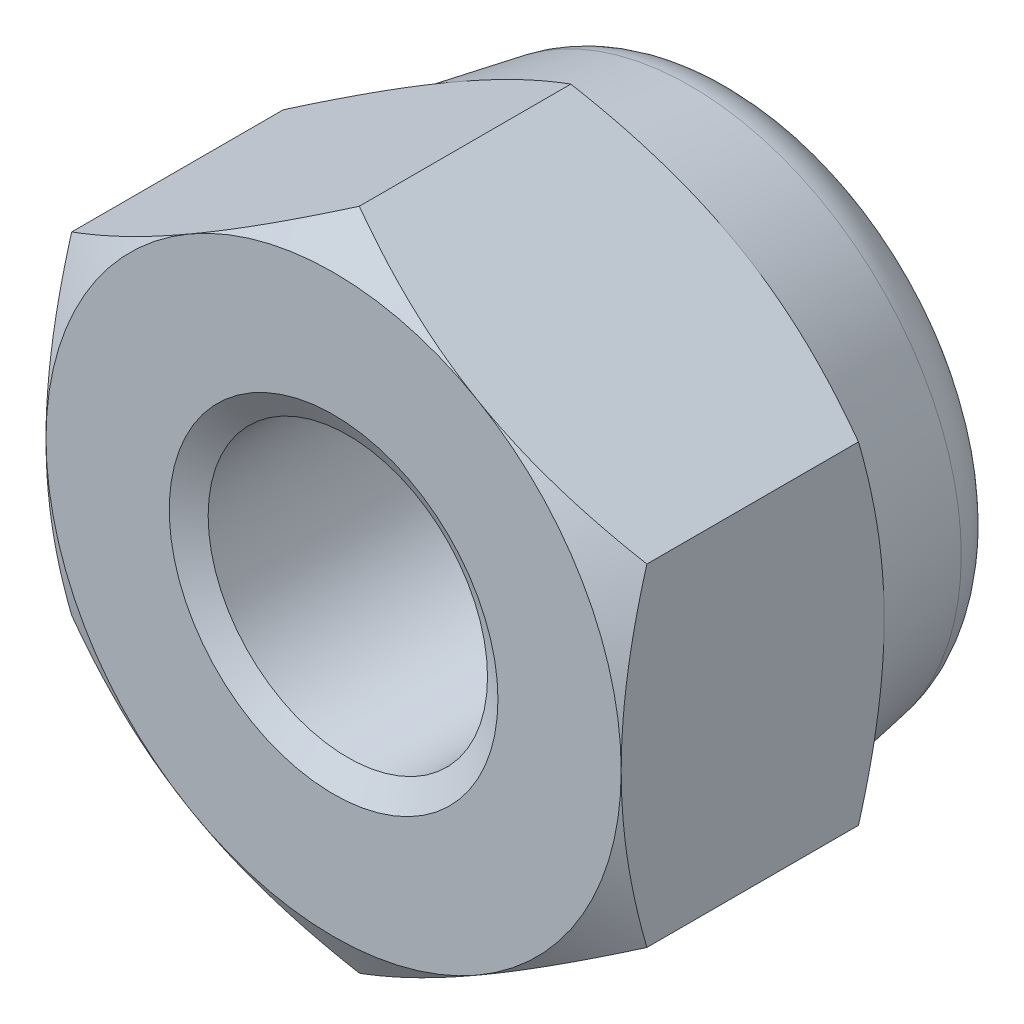
from build123d import *

# Parameters (mm, degrees)
VYSUNOUT1_DEPTH = 3.2
VYSUNOUT2_DEPTH = 1.8
VYSUNOUT2_TAPER = 10
ZAOBLIT1_R      = 0.8
SKICA5_R        = 2
SKICA5_R_2      = 1.7
VYSUNOUT3_DEPTH = 1.78


with BuildPart() as part:
    # Skica1 → Vysunout1 (new body)
    with BuildSketch(Plane.XY):
        Polygon((3.5, -2.020725942), (3.5, 2.020725942), (0, 4.041451884), (-3.5, 2.020725942), (-3.5, -2.020725942), (0, -4.041451884), align=None)
    extrude(amount=VYSUNOUT1_DEPTH)

    # Skica2 → Odebrat otočením1 (revolve, cut)
    with BuildSketch(Plane(origin=(0, 0, 0), x_dir=(1, 0, 0), z_dir=(0, 1, 0))):
        Polygon((6.271281292, -3.2), (6.271281292, -1.6), (3.5, -3.2), align=None)
        Polygon((6.271281292, 0), (3.5, 0), (6.271281292, -1.6), align=None)
    revolve(axis=Axis((0, 0, 0), (0, 0, 1)), mode=Mode.SUBTRACT)

    # Skica3 → Vysunout2 (add)
    with BuildSketch(Plane(origin=(0, 0, 0), x_dir=(-1, 0, 0), z_dir=(0, 0, -1))):
        with BuildLine():
            ThreePointArc((-1.75, 3.031088913), (-3.031088913, 1.75), (-3.5, 0))
            ThreePointArc((-3.5, 0), (-3.031088913, -1.75), (-1.75, -3.031088913))
            ThreePointArc((-1.75, -3.031088913), (0, -3.5), (1.75, -3.031088913))
            ThreePointArc((1.75, -3.031088913), (3.031088913, -1.75), (3.5, 0))
            ThreePointArc((3.5, 0), (3.031088913, 1.75), (1.75, 3.031088913))
            ThreePointArc((1.75, 3.031088913), (0, 3.5), (-1.75, 3.031088913))
        make_face()
    extrude(amount=VYSUNOUT2_DEPTH, taper=VYSUNOUT2_TAPER)

    # Zaoblit1
    zaoblit1_edges = [part.edges().sort_by_distance(p)[0] for p in [
        (0, 3.182611435, -1.8),
    ]]
    fillet(zaoblit1_edges, radius=ZAOBLIT1_R)

    # Skica4 → Odebrat otočením2 (revolve, cut)
    with BuildSketch(Plane(origin=(0, 0, 0), x_dir=(1, 0, 0), z_dir=(0, 1, 0))):
        Polygon((-2, 1.8), (-2, -0.3), (-1.7, -0.3), (-1.7, -3.2), (0, -3.2), (0, 1.8), align=None)
    revolve(axis=Axis((0, 0, -1.8), (0, 0, 1)), mode=Mode.SUBTRACT)

    # Skica6 → Odebrat otočením3 (revolve, cut)
    with BuildSketch(Plane(origin=(0, 0, 0), x_dir=(1, 0, 0), z_dir=(0, 1, 0))):
        Polygon((0, -2.045299462), (2, -3.2), (0, -3.2), align=None)
    revolve(axis=Axis((0, 0, 3.2), (0, 0, -1)), mode=Mode.SUBTRACT)


with BuildPart() as body_2:
    # Skica5 → Vysunout3 (new body)
    with BuildSketch(Plane(origin=(0, 0, 0.3), x_dir=(-1, 0, 0), z_dir=(0, 0, -1))):
        Circle(SKICA5_R)
        Circle(SKICA5_R_2, mode=Mode.SUBTRACT)
    extrude(amount=VYSUNOUT3_DEPTH)


solid = Compound([part.part, body_2.part])
